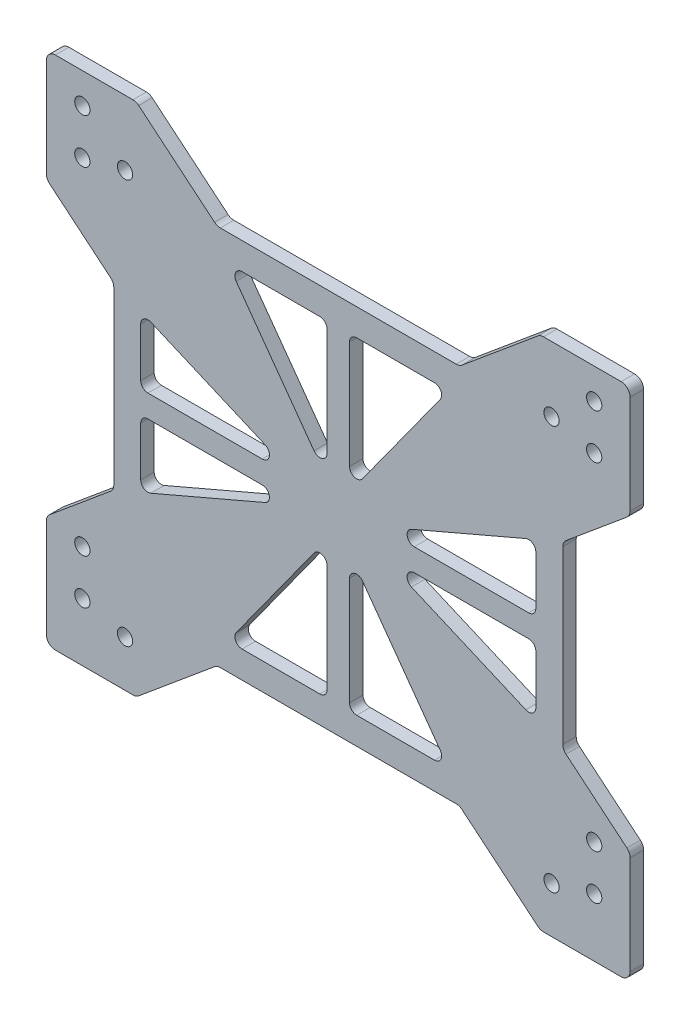
from build123d import *

# Parameters (mm, degrees)
SKETCH_1_W          = 130
SKETCH_1_H          = 114.8
EXTRUDE_1_DEPTH     = 3
SKETCH_2_R          = 1.7
CUT_EXTRUDE_1_DEPTH = 87.768427438
SKETCH_4_R          = 1.7
CUT_EXTRUDE_3_DEPTH = 87.768427438
CUT_EXTRUDE_5_DEPTH = 87.768427438
CUT_EXTRUDE_6_DEPTH = 87.768427438
EXTRUDE_4_DEPTH     = 3
SKETCH_10_W         = 88
SKETCH_10_H         = 5
SKETCH_10_W_2       = 5
SKETCH_10_H_2       = 72.8
EXTRUDE_1_2_DEPTH   = 3
FILLET_2_R          = 1.6
FILLET_3_R          = 2


with BuildPart() as part:
    # 草图1 → Extrude 1 (new body)
    with BuildSketch(Plane.XY):
        Rectangle(SKETCH_1_W, SKETCH_1_H)
    extrude(amount=EXTRUDE_1_DEPTH)

    # 草图2 → 切除-拉伸1 (cut, through all)
    with BuildSketch(Plane(origin=(0, 0, 0), x_dir=(-1, 0, 0), z_dir=(0, 0, -1))):
        with Locations((57, -34.4)):
            Circle(SKETCH_2_R)
        with Locations((57, -44.4)):
            Circle(SKETCH_2_R)
        with Locations((57, 50.6)):
            Circle(SKETCH_2_R)
        with Locations((57, 40.6)):
            Circle(SKETCH_2_R)
        with Locations(Location((-57, -44.4, 0), (0, 0, 180))):
            Circle(SKETCH_2_R)
        with Locations(Location((-57, -34.4, 0), (0, 0, 180))):
            Circle(SKETCH_2_R)
        with Locations(Location((-57, 40.6, 0), (0, 0, 180))):
            Circle(SKETCH_2_R)
        with Locations(Location((-57, 50.6, 0), (0, 0, 180))):
            Circle(SKETCH_2_R)
    extrude(amount=-CUT_EXTRUDE_1_DEPTH, mode=Mode.SUBTRACT)

    # 草图4 → 切除-拉伸3 (cut, through all)
    with BuildSketch(Plane(origin=(0, 0, 0), x_dir=(-1, 0, 0), z_dir=(0, 0, -1))):
        with Locations((-47.5, 42.9)):
            Circle(SKETCH_4_R)
        with Locations((47.5, 42.9)):
            Circle(SKETCH_4_R)
        with Locations((47.5, -47.1)):
            Circle(SKETCH_4_R)
        with Locations((-47.5, -47.1)):
            Circle(SKETCH_4_R)
    extrude(amount=-CUT_EXTRUDE_3_DEPTH, mode=Mode.SUBTRACT)

    # 草图7 → 切除-拉伸5 (cut, through all)
    with BuildSketch(Plane(origin=(0, 0, 0), x_dir=(-1, 0, 0), z_dir=(0, 0, -1))):
        Polygon((-65, 32.5), (-50, 20), (-50, -20), (-65, -32.5), align=None)
        Polygon((50, -20), (65, -32.5), (65, 32.5), (50, 20), align=None)
        Polygon((-45, -57.4), (45, -57.4), (27, -42.4), (-27, -42.4), align=None)
        Polygon((27, 42.4), (-27, 42.4), (-45, 57.4), (45, 57.4), align=None)
    extrude(amount=-CUT_EXTRUDE_5_DEPTH, mode=Mode.SUBTRACT)

    # 草图8 → 切除-拉伸6 (cut, through all)
    with BuildSketch(Plane(origin=(0, 0, 0), x_dir=(-1, 0, 0), z_dir=(0, 0, -1))):
        Polygon((-44, 17.468143152), (-24.561039844, 36.4), (24.561039844, 36.4), (44, 17.468143152), (44, -17.468143152), (24.561039844, -36.4), (-24.561039844, -36.4), (-44, -17.468143152), align=None)
    extrude(amount=-CUT_EXTRUDE_6_DEPTH, mode=Mode.SUBTRACT)

    # 草图9 → 凸台-拉伸4 (add, through all)
    with BuildSketch(Plane(origin=(0, 0, 0), x_dir=(-1, 0, 0), z_dir=(0, 0, -1))):
        Polygon((44, -17.468143152), (3.328333696, 0), (44, 17.468143152), (24.561039844, 36.4), (0, 2.384920184), (-24.561039844, 36.4), (-44, 17.468143152), (-3.328333696, 0), (-44, -17.468143152), (-24.561039844, -36.4), (0, -2.384920184), (24.561039844, -36.4), align=None)
    extrude(amount=-EXTRUDE_4_DEPTH)

    # 草图10 → Extrude 1 2 (add, through all)
    with BuildSketch(Plane(origin=(0, 0, 0), x_dir=(-1, 0, 0), z_dir=(0, 0, -1))):
        Rectangle(SKETCH_10_W, SKETCH_10_H)
        Rectangle(SKETCH_10_W_2, SKETCH_10_H_2)
    extrude(amount=-EXTRUDE_1_2_DEPTH)

    # 圆角2
    fillet_2_edges = [part.edges().sort_by_distance(p)[0] for p in [
        (44, -17.468143152, 1.5),
        (44, 17.468143152, 1.5),
        (24.561039844, 36.4, 1.5),
        (-24.561039844, 36.4, 1.5),
        (-44, 17.468143152, 1.5),
        (-44, -17.468143152, 1.5),
        (-24.561039844, -36.4, 1.5),
        (24.561039844, -36.4, 1.5),
        (2.5, 5.847220644, 1.5),
        (9.149167935, 2.5, 1.5),
        (9.149167935, -2.5, 1.5),
        (2.5, -5.847220644, 1.5),
        (-2.5, -5.847220644, 1.5),
        (-9.149167935, -2.5, 1.5),
        (-9.149167935, 2.5, 1.5),
        (-2.5, 5.847220644, 1.5),
        (-2.5, 36.4, 1.5),
        (-44, -2.5, 1.5),
        (2.5, -36.4, 1.5),
        (44, -2.5, 1.5),
        (44, 2.5, 1.5),
        (-44, 2.5, 1.5),
        (2.5, 36.4, 1.5),
        (-2.5, -36.4, 1.5),
    ]]
    fillet(fillet_2_edges, radius=FILLET_2_R)

    # 圆角3
    fillet_3_edges = [part.edges().sort_by_distance(p)[0] for p in [
        (65, -32.5, 1.5),
        (65, 32.5, 1.5),
        (50, 20, 1.5),
        (50, -20, 1.5),
        (-50, -20, 1.5),
        (-50, 20, 1.5),
        (-65, 32.5, 1.5),
        (-65, -32.5, 1.5),
        (45, -57.4, 1.5),
        (27, -42.4, 1.5),
        (-27, -42.4, 1.5),
        (-45, -57.4, 1.5),
        (-45, 57.4, 1.5),
        (-27, 42.4, 1.5),
        (27, 42.4, 1.5),
        (45, 57.4, 1.5),
        (65, -57.4, 1.5),
        (-65, -57.4, 1.5),
        (-65, 57.4, 1.5),
        (65, 57.4, 1.5),
    ]]
    fillet(fillet_3_edges, radius=FILLET_3_R)


solid = part.part
